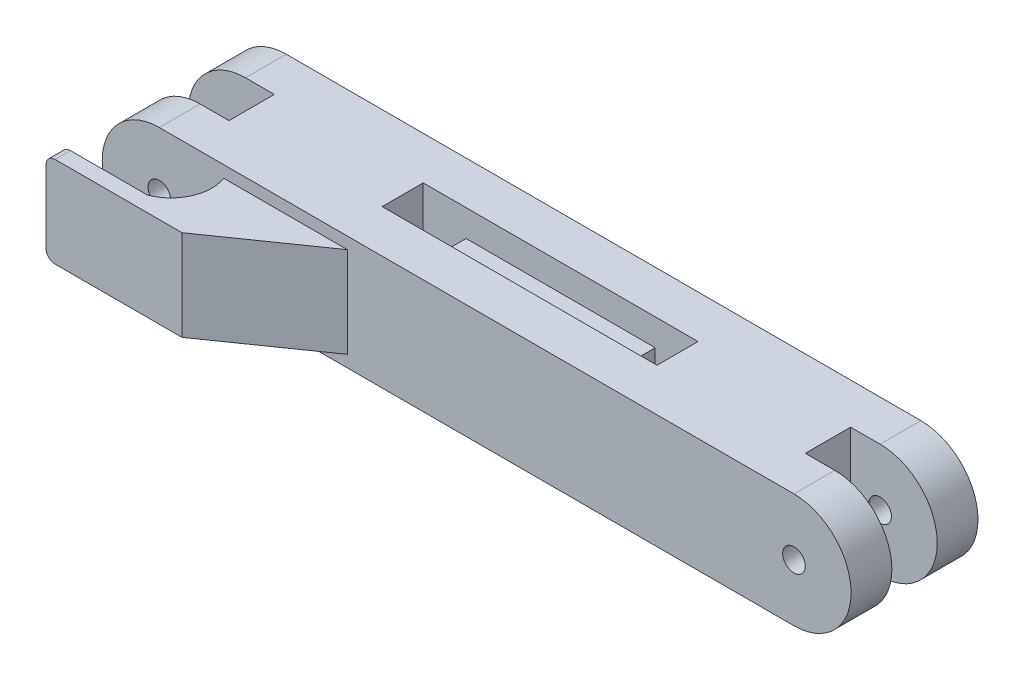
from build123d import *

# Parameters (mm, degrees)
SKETCH1_R           = 3.175
BOSS_EXTRUDE1_DEPTH = 11.43
SKETCH2_W           = 161.464261653
SKETCH2_H           = 32
BOSS_EXTRUDE2_DEPTH = 12.7
SKETCH5_R           = 3.175
BOSS_EXTRUDE3_DEPTH = 11.43
SKETCH6_W           = 77
SKETCH6_H           = 11.5
CUT_EXTRUDE1_DEPTH  = 7.5
BOSS_EXTRUDE4_DEPTH = 19.05
CUT_EXTRUDE3_DEPTH  = 30.48
BOSS_EXTRUDE5_DEPTH = 25.4
SKETCH7_W           = 12
SKETCH7_H           = 11.5
CUT_EXTRUDE4_DEPTH  = 50.8
SKETCH7_5_W         = 12
SKETCH7_5_H         = 11.5
CUT_EXTRUDE5_DEPTH  = 50.8


with BuildPart() as part:
    # Sketch1 → Boss-Extrude1 (new body)
    with BuildSketch(Plane.XY):
        with BuildLine():
            Line((-47.217391304, 7.923913043), (130.582608696, 7.923913043))
            ThreePointArc((130.582608696, 7.923913043), (146.582608696, -8.076086957), (130.582608696, -24.076086957))
            Line((130.582608696, -24.076086957), (-47.217391304, -24.076086957))
            ThreePointArc((-47.217391304, -24.076086957), (-63.217391304, -8.076086957), (-47.217391304, 7.923913043))
        make_face()
        with Locations((-47.217391304, -8.076086957)):
            Circle(SKETCH1_R, mode=Mode.SUBTRACT)
        with Locations((130.582608696, -8.076086957)):
            Circle(SKETCH1_R, mode=Mode.SUBTRACT)
    extrude(amount=BOSS_EXTRUDE1_DEPTH)

    # Sketch2 → Boss-Extrude2 (add)
    with BuildSketch(Plane.XY.offset(11.43)):
        with Locations((41.59547787, -8.076086957)):
            Rectangle(SKETCH2_W, SKETCH2_H)
    extrude(amount=BOSS_EXTRUDE2_DEPTH)

    # Sketch5 → Boss-Extrude3 (add)
    with BuildSketch(Plane.XY.offset(24.13)):
        with BuildLine():
            Line((-47.217391304, 7.923913043), (130.582608696, 7.923913043))
            ThreePointArc((130.582608696, 7.923913043), (146.582608696, -8.076086957), (130.582608696, -24.076086957))
            Line((130.582608696, -24.076086957), (-47.217391304, -24.076086957))
            ThreePointArc((-47.217391304, -24.076086957), (-63.217391304, -8.076086957), (-47.217391304, 7.923913043))
        make_face()
        with Locations((-47.217391304, -8.076086957)):
            Circle(SKETCH5_R, mode=Mode.SUBTRACT)
        with Locations((130.582608696, -8.076086957)):
            Circle(SKETCH5_R, mode=Mode.SUBTRACT)
    extrude(amount=BOSS_EXTRUDE3_DEPTH)

    # Sketch6 → Cut-Extrude1 (cut)
    with BuildSketch(Plane(origin=(0, 7.923913043, 0), x_dir=(1, 0, 0), z_dir=(0, 1, 0))):
        with Locations((41.682608696, -17.78)):
            Rectangle(SKETCH6_W, SKETCH6_H)
    extrude(amount=-CUT_EXTRUDE1_DEPTH, mode=Mode.SUBTRACT)

    # Sketch10 → Boss-Extrude4 (add)
    with BuildSketch(Plane.XY.offset(35.56)):
        with BuildLine():
            Line((-34.517391304, -20.776086957), (-57.377391304, -20.776086957))
            ThreePointArc((-57.377391304, -20.776086957), (-59.173442529, -20.032138181), (-59.917391304, -18.236086957))
            Line((-59.917391304, -18.236086957), (-59.917391304, 2.083913043))
            ThreePointArc((-59.917391304, 2.083913043), (-59.173442529, 3.879964268), (-57.377391304, 4.623913043))
            Line((-57.377391304, 4.623913043), (-34.517391304, 4.623913043))
            Line((-34.517391304, 4.623913043), (-21.817391304, 4.623913043))
            Line((-21.817391304, 4.623913043), (-21.817391304, -20.776086957))
            Line((-21.817391304, -20.776086957), (-34.517391304, -20.776086957))
        make_face()
    extrude(amount=BOSS_EXTRUDE4_DEPTH)

    # Sketch14 → Cut-Extrude3 (cut)
    with BuildSketch(Plane(origin=(0, 4.623913043, 0), x_dir=(1, 0, 0), z_dir=(0, 1, 0))):
        with BuildLine():
            Line((-59.917391304, -35.56), (-29.183391304, -35.56))
            ThreePointArc((-29.183391304, -35.56), (-29.434604535, -44.304535578), (-35.79555952, -50.310221405))
            Line((-35.79555952, -50.310221405), (-59.917391304, -50.310221405))
            Line((-59.917391304, -50.310221405), (-59.917391304, -35.56))
        make_face()
    extrude(amount=-CUT_EXTRUDE3_DEPTH, mode=Mode.SUBTRACT)

    # Sketch15 → Boss-Extrude5 (add)
    with BuildSketch(Plane.XZ.offset(20.776086957)):
        Polygon((-21.817391304, 35.56), (5.46367495, 35.56), (-21.817391304, 54.61), align=None)
    extrude(amount=-BOSS_EXTRUDE5_DEPTH)

    # Sketch7 → Cut-Extrude4 (cut)
    with BuildSketch(Plane(origin=(0, 0.423913043, 0), x_dir=(1, 0, 0), z_dir=(0, 1, 0))):
        with Locations((74.182608696, -17.78)):
            Rectangle(SKETCH7_W, SKETCH7_H)
    extrude(amount=-CUT_EXTRUDE4_DEPTH, mode=Mode.SUBTRACT)

    # Sketch7<5> → Cut-Extrude5 (cut)
    with BuildSketch(Plane(origin=(0, 0.423913043, 0), x_dir=(1, 0, 0), z_dir=(0, 1, 0))):
        with Locations((9.182608696, -17.78)):
            Rectangle(SKETCH7_5_W, SKETCH7_5_H)
    extrude(amount=-CUT_EXTRUDE5_DEPTH, mode=Mode.SUBTRACT)


solid = part.part
